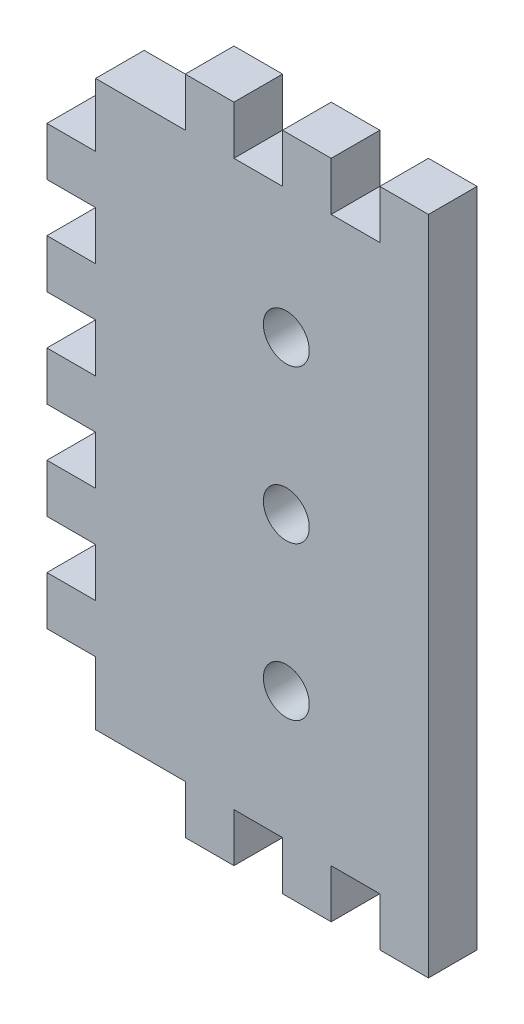
from build123d import *

# Parameters (mm, degrees)
SKETCH1_W            = 24.91
SKETCH1_H            = 40.005
BOSS_EXTRUDE1_DEPTH  = 3.175
SKETCH7_W            = 3.175
SKETCH7_H            = 3.175
CUT_EXTRUDE5_DEPTH   = 3.175
LPATTERN2_COUNT      = 6
LPATTERN2_PITCH      = 6.35
LPATTERN2_COUNT_DIR2 = 6
LPATTERN2_PITCH_DIR2 = 6.35
SKETCH8_W            = 3.175
SKETCH8_H            = 0.955
SKETCH8_H_2          = 3.175
CUT_EXTRUDE6_DEPTH   = 3.175
SKETCH9_W            = 3.175
SKETCH9_H            = 3.175
CUT_EXTRUDE7_DEPTH   = 3.175
LPATTERN3_COUNT      = 3
LPATTERN3_PITCH      = 6.35
SKETCH10_W           = 2.685
SKETCH10_H           = 3.175
CUT_EXTRUDE8_DEPTH   = 3.175
SKETCH12_W           = 3.175
SKETCH12_H           = 3.175
BOSS_EXTRUDE2_DEPTH  = 3.175
LPATTERN4_COUNT      = 3
LPATTERN4_PITCH      = 6.35
SKETCH11_R           = 1.5
CUT_EXTRUDE9_DEPTH   = 3.175
LPATTERN5_COUNT      = 3
LPATTERN5_PITCH      = 10


with BuildPart() as part:
    # Sketch1 → Boss-Extrude1 (new body)
    with BuildSketch(Plane.XY):
        with Locations((12.455, 20.0025)):
            Rectangle(SKETCH1_W, SKETCH1_H)
    extrude(amount=BOSS_EXTRUDE1_DEPTH)

    # Sketch7 → Cut-Extrude5 (cut)
    with BuildSketch(Plane(origin=(0, 0, 0), x_dir=(-1, 0, 0), z_dir=(0, 0, -1))):
        with Locations((-1.5875, 31.1125)):
            Rectangle(SKETCH7_W, SKETCH7_H)
    cut_extrude5 = extrude(amount=-CUT_EXTRUDE5_DEPTH, mode=Mode.SUBTRACT)

    # LPattern2: Cut-Extrude5 6 × 6
    with Locations(*[Vector(0, -1, 0) * (i * LPATTERN2_PITCH) + Vector(0, 1, 0) * (j * LPATTERN2_PITCH_DIR2) for i in range(LPATTERN2_COUNT) for j in range(LPATTERN2_COUNT_DIR2) if (i, j) != (0, 0)]):
        add(cut_extrude5, mode=Mode.SUBTRACT)

    # Sketch8 → Cut-Extrude6 (cut)
    with BuildSketch(Plane(origin=(0, 0, 0), x_dir=(-1, 0, 0), z_dir=(0, 0, -1))):
        with Locations((-1.5875, 39.5275)):
            Rectangle(SKETCH8_W, SKETCH8_H)
        with Locations((-1.5875, 2.5375)):
            Rectangle(SKETCH8_W, SKETCH8_H_2)
    extrude(amount=-CUT_EXTRUDE6_DEPTH, mode=Mode.SUBTRACT)

    # Sketch9 → Cut-Extrude7 (cut)
    with BuildSketch(Plane(origin=(0, 0, 0), x_dir=(-1, 0, 0), z_dir=(0, 0, -1))):
        with Locations((-20.1475, 1.5875)):
            Rectangle(SKETCH9_W, SKETCH9_H)
    cut_extrude7 = extrude(amount=-CUT_EXTRUDE7_DEPTH, mode=Mode.SUBTRACT)

    # LPattern3: Cut-Extrude7 ×3
    with Locations(*[(-i * LPATTERN3_PITCH, 0, 0) for i in range(1, LPATTERN3_COUNT)]):
        add(cut_extrude7, mode=Mode.SUBTRACT)

    # Sketch10 → Cut-Extrude8 (cut)
    with BuildSketch(Plane(origin=(0, 0, 0), x_dir=(-1, 0, 0), z_dir=(0, 0, -1))):
        with Locations((-4.5175, 1.5875)):
            Rectangle(SKETCH10_W, SKETCH10_H)
    extrude(amount=-CUT_EXTRUDE8_DEPTH, mode=Mode.SUBTRACT)

    # Sketch12 → Boss-Extrude2 (add)
    with BuildSketch(Plane(origin=(0, 0, 0), x_dir=(-1, 0, 0), z_dir=(0, 0, -1))):
        with Locations((-23.3225, 41.5925)):
            Rectangle(SKETCH12_W, SKETCH12_H)
    boss_extrude2 = extrude(amount=-BOSS_EXTRUDE2_DEPTH)

    # LPattern4: Boss-Extrude2 ×3
    with Locations(*[(-i * LPATTERN4_PITCH, 0, 0) for i in range(1, LPATTERN4_COUNT)]):
        add(boss_extrude2)

    # Sketch11 → Cut-Extrude9 (cut)
    with BuildSketch(Plane(origin=(0, 0, 0), x_dir=(-1, 0, 0), z_dir=(0, 0, -1))):
        with Locations((-15.63, 31.589068697)):
            Circle(SKETCH11_R)
    cut_extrude9 = extrude(amount=-CUT_EXTRUDE9_DEPTH, mode=Mode.SUBTRACT)

    # LPattern5: Cut-Extrude9 ×3
    with Locations(*[(0, -i * LPATTERN5_PITCH, 0) for i in range(1, LPATTERN5_COUNT)]):
        add(cut_extrude9, mode=Mode.SUBTRACT)


solid = part.part
